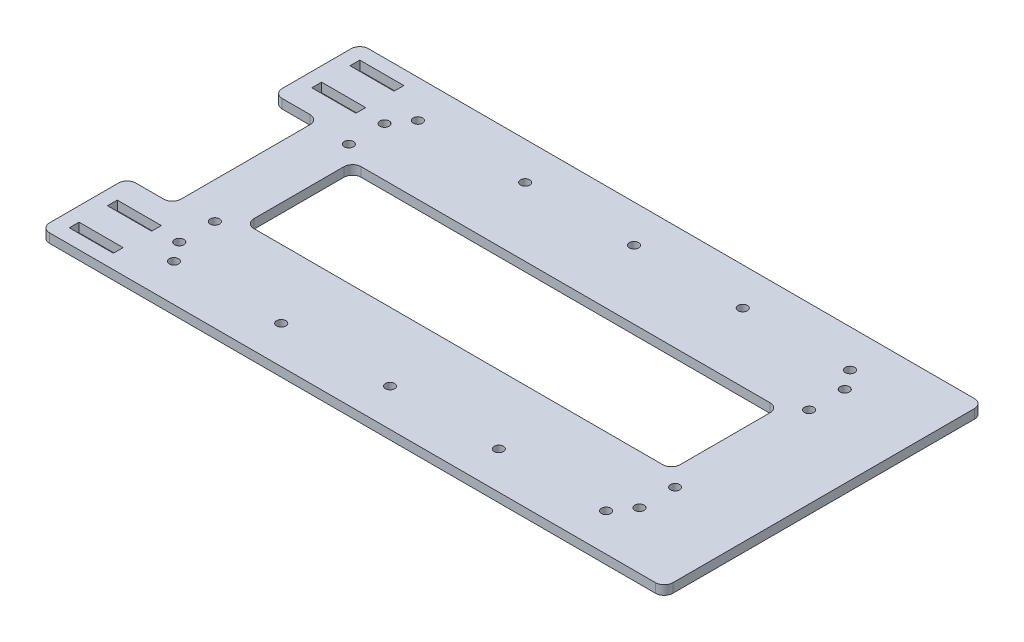
from build123d import *

# Parameters (mm, degrees)
SKETCH1_W           = 215
SKETCH1_H           = 110
BOSS_EXTRUDE1_DEPTH = 3.175
SKETCH2_W           = 147
SKETCH2_H           = 37
CUT_EXTRUDE1_DEPTH  = 121.79458028
SKETCH3_W           = 15.6
SKETCH3_H           = 50.5
CUT_EXTRUDE2_DEPTH  = 121.79458028
SKETCH5_R           = 1.6
CUT_EXTRUDE4_DEPTH  = 121.79458028
SKETCH6_R           = 1.6
CUT_EXTRUDE5_DEPTH  = 121.79458028
FILLET1_R           = 3
CUT_EXTRUDE6_DEPTH  = 121.79458028


with BuildPart() as part:
    # Sketch1 → Boss-Extrude1 (new body)
    with BuildSketch(Plane(origin=(0, 0, 0), x_dir=(1, 0, 0), z_dir=(0, 1, 0))):
        Rectangle(SKETCH1_W, SKETCH1_H)
    extrude(amount=BOSS_EXTRUDE1_DEPTH)

    # Sketch2 → Cut-Extrude1 (cut, through all)
    with BuildSketch(Plane.XZ):
        Rectangle(SKETCH2_W, SKETCH2_H)
    extrude(amount=-CUT_EXTRUDE1_DEPTH, mode=Mode.SUBTRACT)

    # Sketch3 → Cut-Extrude2 (cut, through all)
    with BuildSketch(Plane.XZ):
        with Locations((-99.7, 0)):
            Rectangle(SKETCH3_W, SKETCH3_H)
    extrude(amount=-CUT_EXTRUDE2_DEPTH, mode=Mode.SUBTRACT)

    # Sketch5 → Cut-Extrude4 (cut, through all)
    with BuildSketch(Plane.XZ):
        with Locations(Location((-79.375, 23.1, 0), (0, 0, 270))):
            Circle(SKETCH5_R)
        with Locations(Location((-79.375, -23.1, 0), (0, 0, 90))):
            Circle(SKETCH5_R)
        with Locations(Location((79.375, -23.1, 0), (0, 0, 270))):
            Circle(SKETCH5_R)
        with Locations(Location((79.375, 23.1, 0), (0, 0, 90))):
            Circle(SKETCH5_R)
        with Locations(Location((-79.375, 35.4, 0), (0, 0, 270))):
            Circle(SKETCH5_R)
        with Locations(Location((-79.375, -35.4, 0), (0, 0, 90))):
            Circle(SKETCH5_R)
        with Locations(Location((79.375, 35.4, 0), (0, 0, 90))):
            Circle(SKETCH5_R)
        with Locations(Location((79.375, -35.4, 0), (0, 0, 270))):
            Circle(SKETCH5_R)
    extrude(amount=-CUT_EXTRUDE4_DEPTH, mode=Mode.SUBTRACT)

    # Sketch6 → Cut-Extrude5 (cut, through all)
    with BuildSketch(Plane(origin=(0, 3.175, 0), x_dir=(1, 0, 0), z_dir=(0, 1, 0))):
        with Locations(Location((37.528255169, 42.068885296, 0), (0, 0, 270))):
            Circle(SKETCH6_R)
        with Locations(Location((0, 42.068885296, 0), (0, 0, 270))):
            Circle(SKETCH6_R)
        with Locations(Location((-37.528255169, 42.068885296, 0), (0, 0, 270))):
            Circle(SKETCH6_R)
        with Locations(Location((-74.528255169, 42.068885296, 0), (0, 0, 270))):
            Circle(SKETCH6_R)
        with Locations(Location((74.528255169, -42.068885296, 0), (0, 0, 270))):
            Circle(SKETCH6_R)
        with Locations(Location((37.528255169, -42.068885296, 0), (0, 0, 270))):
            Circle(SKETCH6_R)
        with Locations(Location((0, -42.068885296, 0), (0, 0, 270))):
            Circle(SKETCH6_R)
        with Locations(Location((-37.528255169, -42.068885296, 0), (0, 0, 270))):
            Circle(SKETCH6_R)
        with Locations(Location((-74.528255169, -42.068885296, 0), (0, 0, 270))):
            Circle(SKETCH6_R)
        with Locations(Location((74.528255169, 42.068885296, 0), (0, 0, 270))):
            Circle(SKETCH6_R)
    extrude(amount=-CUT_EXTRUDE5_DEPTH, mode=Mode.SUBTRACT)

    # Fillet1
    fillet1_edges = [part.edges().sort_by_distance(p)[0] for p in [
        (-73.5, 1.5875, -18.5),
        (-73.5, 1.5875, 18.5),
        (73.5, 1.5875, 18.5),
        (73.5, 1.5875, -18.5),
        (-107.5, 1.5875, -25.25),
        (-107.5, 1.5875, 25.25),
        (-91.9, 1.5875, 25.25),
        (-91.9, 1.5875, -25.25),
        (-107.5, 1.5875, -55),
        (107.5, 1.5875, -55),
        (107.5, 1.5875, 55),
        (-107.5, 1.5875, 55),
    ]]
    fillet(fillet1_edges, radius=FILLET1_R)

    # Sketch7 → Cut-Extrude6 (cut, through all)
    with BuildSketch(Plane.XZ):
        Polygon((-87.4, -46.725), (-88.5, -46.725), (-101.5, -46.725), (-102.6, -46.725), (-102.6, -50.1), (-101.5, -50.1), (-88.5, -50.1), (-87.4, -50.1), align=None)
        Polygon((-101.5, -33.55), (-102.6, -33.55), (-102.6, -36.925), (-101.5, -36.925), (-88.5, -36.925), (-87.4, -36.925), (-87.4, -33.55), (-88.5, -33.55), align=None)
        Polygon((-87.4, 50.1), (-88.5, 50.1), (-101.5, 50.1), (-102.6, 50.1), (-102.6, 46.725), (-101.5, 46.725), (-88.5, 46.725), (-87.4, 46.725), align=None)
        Polygon((-101.5, 36.925), (-102.6, 36.925), (-102.6, 33.55), (-101.5, 33.55), (-88.5, 33.55), (-87.4, 33.55), (-87.4, 36.925), (-88.5, 36.925), align=None)
    extrude(amount=-CUT_EXTRUDE6_DEPTH, mode=Mode.SUBTRACT)


solid = part.part
